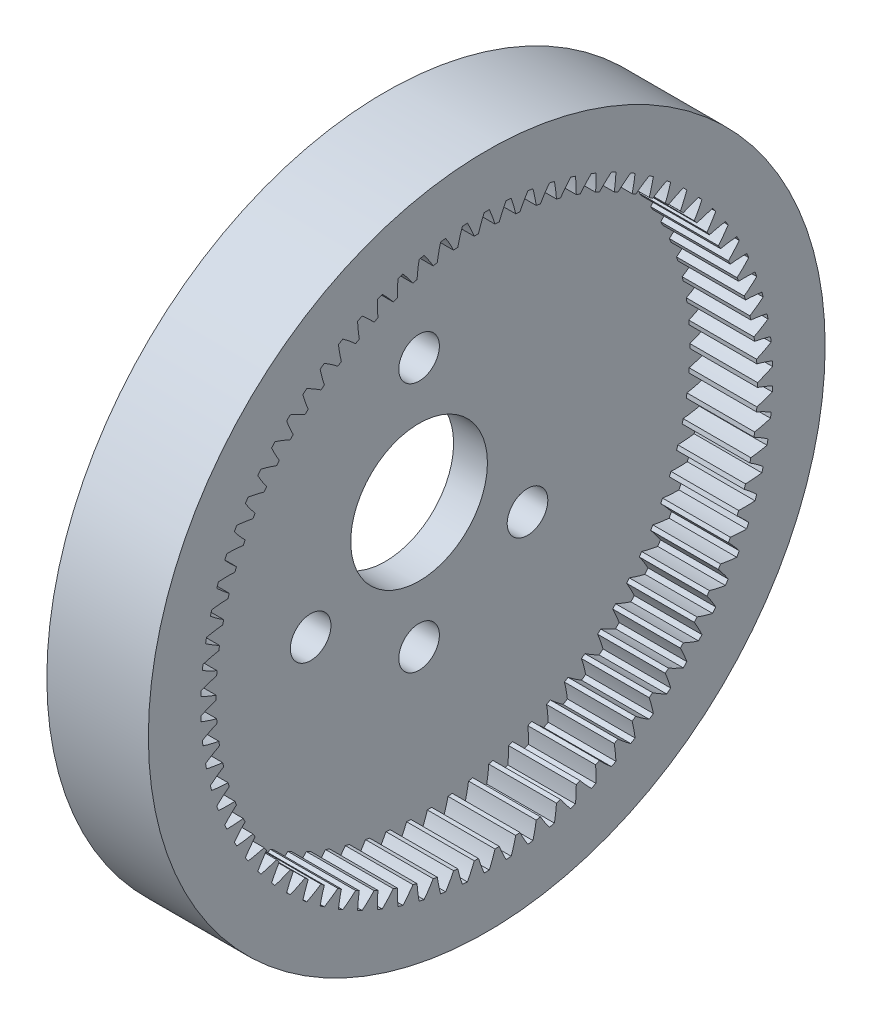
from build123d import *

# Parameters (mm, degrees)
BASPROSKE_W             = 12
BASPROSKE_H             = 5
TOOTHCUT_DEPTH          = 38.336309405
TEETHCUTS_COUNT         = 82
SKETCH2_R               = 25
BOSS_EXTRUDE1_DEPTH     = 2.5
CUT_EXTRUDE1_DEPTH      = 39.213217609
CUT_EXTRUDE1_DEPTH_BACK = 2.5
SKETCH3_R               = 5.05
SKETCH3_R_2             = 1.5
SKETCH4_R               = 25
CUT_EXTRUDE2_DEPTH      = 7


with BuildPart() as part:
    # BasProSke → Base-Revolve (revolve)
    with BuildSketch(Plane(origin=(0, 0, 0), x_dir=(1, 0, 0), z_dir=(0, 1, 0)), mode=Mode.PRIVATE) as base_revolve_sk:
        with Locations((6, 22.5)):
            Rectangle(BASPROSKE_W, BASPROSKE_H)
    revolve(base_revolve_sk.sketch.rotate(Axis((-10, 0, 0), (1, 0, 0)), 180), axis=Axis((-10, 0, 0), (1, 0, 0)))

    # TooCutSke → ToothCut (cut, through all)
    with BuildSketch(Plane(origin=(0, 0, 0), x_dir=(0, 0, -1), z_dir=(1, 0, 0))):
        with BuildLine():
            ThreePointArc((0.616445603, 19.965085524), (0.419540464, 20.551600293), (0.187608392, 21.12516696))
            ThreePointArc((0.187608392, 21.12516696), (0, 21.126), (-0.187608392, 21.12516696))
            ThreePointArc((-0.187608392, 21.12516696), (-0.419540464, 20.551600293), (-0.616445603, 19.965085524))
            ThreePointArc((-0.616445603, 19.965085524), (0, 19.9746), (0.616445603, 19.965085524))
        make_face()
    toothcut = extrude(amount=TOOTHCUT_DEPTH, mode=Mode.SUBTRACT)

    # TeethCuts: ToothCut ×82 about axis
    teethcuts_axis = Axis((0, 0, 0), (1, 0, 0))
    for i in range(1, TEETHCUTS_COUNT):
        add(toothcut.rotate(teethcuts_axis, i * 360 / TEETHCUTS_COUNT), mode=Mode.SUBTRACT)

    # Sketch2 → Boss-Extrude1 (add)
    with BuildSketch(Plane.ZY):
        Circle(SKETCH2_R)
    extrude(amount=BOSS_EXTRUDE1_DEPTH)

    # Sketch3 → Cut-Extrude1 (cut, two sides: drawn at the far end of the back side and taken through both)
    with BuildSketch(Plane.ZY.offset(2.5).offset(-CUT_EXTRUDE1_DEPTH_BACK)):
        with Locations(Location((0, 0, 0), (0, 0, 180))):
            Circle(SKETCH3_R)
        with Locations(Location((0, 9.25, 0), (0, 0, 180))):
            Circle(SKETCH3_R_2)
        with Locations(Location((0, -9.25, 0), (0, 0, 180))):
            Circle(SKETCH3_R_2)
        with Locations(Location((8.010734985, -4.625, 0), (0, 0, 180))):
            Circle(SKETCH3_R_2)
        with Locations(Location((-8.010734985, -4.625, 0), (0, 0, 180))):
            Circle(SKETCH3_R_2)
    extrude(amount=CUT_EXTRUDE1_DEPTH + CUT_EXTRUDE1_DEPTH_BACK, mode=Mode.SUBTRACT)

    # Sketch4 → Cut-Extrude2 (cut)
    with BuildSketch(Plane(origin=(12, 0, 0), x_dir=(0, 0, -1), z_dir=(1, 0, 0))):
        with Locations(Location((0, 0, 0), (0, 0, 180))):
            Circle(SKETCH4_R)
    extrude(amount=-CUT_EXTRUDE2_DEPTH, mode=Mode.SUBTRACT)


solid = part.part
